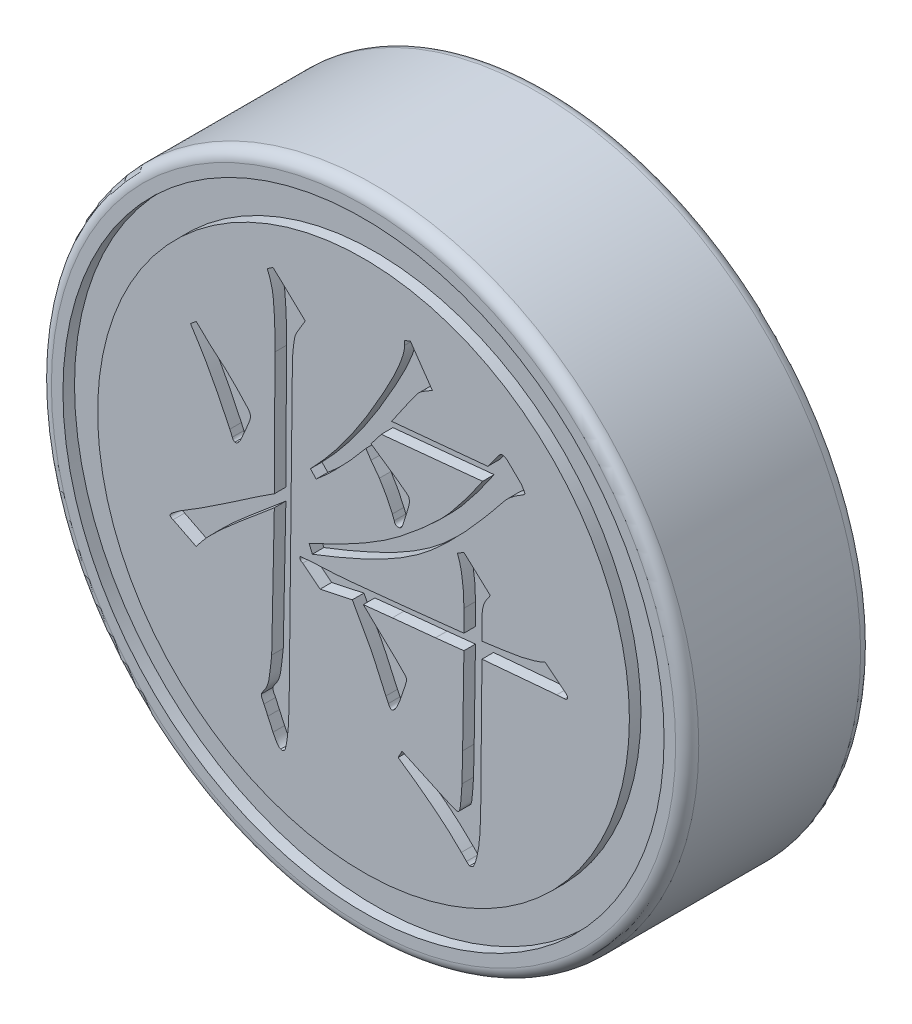
from build123d import *

# Parameters (mm, degrees)
SKETCH_1_R          = 14
EXTRUDE_1_DEPTH     = 8
SKETCH_2_R          = 13
SKETCH_2_R_2        = 11.5
CUT_EXTRUDE_1_DEPTH = 0.5
SKETCH_3_R          = 5.1
CUT_EXTRUDE_2_DEPTH = 5
CHAMFER_1_SIZE      = 0.5
FILLET_1_R          = 0.5
CUT_EXTRUDE_4_DEPTH = 0.5


with BuildPart() as part:
    # 草图1 → 凸台-拉伸1 (new body)
    with BuildSketch(Plane.XY):
        Circle(SKETCH_1_R)
    extrude(amount=EXTRUDE_1_DEPTH)

    # 草图2 → 切除-拉伸1 (cut)
    with BuildSketch(Plane.XY.offset(8)):
        Circle(SKETCH_2_R)
        Circle(SKETCH_2_R_2, mode=Mode.SUBTRACT)
    extrude(amount=-CUT_EXTRUDE_1_DEPTH, mode=Mode.SUBTRACT)

    # 草图3 → 切除-拉伸2 (cut)
    with BuildSketch(Plane(origin=(0, 0, 0), x_dir=(-1, 0, 0), z_dir=(0, 0, -1))):
        Circle(SKETCH_3_R)
    extrude(amount=-CUT_EXTRUDE_2_DEPTH, mode=Mode.SUBTRACT)

    # 倒角1
    chamfer_1_edges = [part.edges().sort_by_distance(p)[0] for p in [
        (5.1, 0, 0),
    ]]
    chamfer(chamfer_1_edges, length=CHAMFER_1_SIZE)

    # 圆角1
    fillet_1_edges = [part.edges().sort_by_distance(p)[0] for p in [
        (-14, 0, 0),
        (-14, 0, 8),
    ]]
    fillet(fillet_1_edges, radius=FILLET_1_R)

    # 草图5 → 切除-拉伸4 (cut)
    with BuildSketch(Plane.XY.offset(8)):
        with BuildLine():
            Line((-3.85785957, 0.753181604), (-3.830158739, 6.08005141))
            add(Edge.make_bspline(
                [(-3.830158739, 6.08005141), (-3.831364823, 6.224089211), (-3.833645566, 6.49646907), (-3.832589616, 6.878881899), (-3.846872254, 7.211166179), (-3.855467977, 7.497624344), (-3.873070618, 7.746912058), (-3.892573003, 7.96760547), (-3.91330196, 8.163780836), (-3.951159163, 8.398958357), (-4.022230098, 8.692417239), (-4.11578704, 8.916857126), (-4.165338794, 9.03573008)],
                knots=[0, 0, 0, 0, 1.441948632, 2.726768687, 3.82731529, 4.770833155, 5.5953337, 6.328397192, 6.988807953, 7.569284558, 8.712589244, 10, 10, 10, 10], degree=3))
            Line((-4.165338794, 9.03573008), (-3.913261232, 9.20470515))
            Line((-3.913261232, 9.20470515), (-2.519909431, 7.894455842))
            add(Edge.make_bspline(
                [(-2.519909431, 7.894455842), (-2.574703725, 7.806940328), (-2.671681638, 7.652050627), (-2.796092194, 7.444535731), (-2.880684556, 7.292009214), (-2.938139052, 7.181515682), (-2.970150997, 7.082319931), (-2.993870979, 6.968104268), (-3.014553443, 6.824493455), (-3.043932148, 6.60149774), (-3.068391363, 6.319705215), (-3.074031335, 6.094869904), (-3.076696135, 5.988638668)],
                knots=[0, 0, 0, 0, 1.52542796, 2.699785109, 3.572888092, 4.103644722, 4.534997392, 5.107576427, 5.825231127, 6.677957643, 8.43038593, 10, 10, 10, 10], degree=3))
            Line((-3.076696135, 5.988638668), (-3.217970373, -6.87562726))
            add(Edge.make_bspline(
                [(-3.217970373, -6.87562726), (-3.222362694, -6.998442437), (-3.230323012, -7.221023575), (-3.24400192, -7.520225409), (-3.257039544, -7.750205328), (-3.274995679, -7.966686115), (-3.306652214, -8.197528505), (-3.340841548, -8.416139218), (-3.385076311, -8.571843104), (-3.427760128, -8.658985824), (-3.506588605, -8.694052613), (-3.555081376, -8.678765136), (-3.580851259, -8.670641111)],
                knots=[0, 0, 0, 0, 1.884211783, 3.414806023, 4.591967612, 5.416119352, 6.743635864, 8.168157045, 8.790582467, 9.242277468, 9.597333355, 10, 10, 10, 10], degree=3))
            add(Edge.make_bspline(
                [(-3.580851259, -8.670641111), (-3.606015163, -8.658243583), (-3.668642248, -8.62738903), (-3.742174602, -8.523978304), (-3.830488817, -8.38402528), (-3.883323333, -8.269922057), (-3.913261232, -8.20526715)],
                knots=[0, 0, 0, 0, 0.570505039, 1.419853925, 2.537998313, 4, 4, 4, 4], degree=3))
            Line((-3.913261232, -8.20526715), (-4.137637963, -7.717732524))
            Line((-4.137637963, -7.717732524), (-4.303842949, -7.343771305))
            add(Edge.make_bspline(
                [(-4.303842949, -7.343771305), (-4.32504177, -7.307225751), (-4.362886764, -7.241983148), (-4.401541068, -7.151267356), (-4.423739186, -7.080499123), (-4.419217867, -7.04096431), (-4.417416356, -7.025211748)],
                knots=[0, 0, 0, 0, 1.469798198, 2.623943312, 3.451713122, 4, 4, 4, 4], degree=3))
            add(Edge.make_bspline(
                [(-4.417416356, -7.025211748), (-4.415159561, -7.014832831), (-4.408727343, -6.9852513), (-4.371189361, -6.937345293), (-4.328937288, -6.861241226), (-4.257216751, -6.769682701), (-4.185529109, -6.646723467), (-4.129795655, -6.488578794), (-4.082034128, -6.301525957), (-4.052994762, -6.091253604), (-4.032095077, -5.877199721), (-4.003603181, -5.679370942), (-3.989733879, -5.503338748), (-3.97725415, -5.394526708), (-3.971432977, -5.343771305)],
                knots=[0, 0, 0, 0, 0.214283448, 0.610741237, 1.210381572, 1.992533091, 2.969273694, 4.093299855, 5.392392195, 6.894141364, 8.407137992, 9.770829503, 10.960202871, 12, 12, 12, 12], degree=3))
            Line((-3.971432977, -5.343771305), (-3.85785957, 0.229635897))
            add(Edge.make_bspline(
                [(-3.85785957, 0.229635897), (-3.878168271, 0.212085931), (-3.931667913, 0.165853683), (-4.030456688, 0.080892432), (-4.166425216, -0.03626467), (-4.34208605, -0.182650137), (-4.554173082, -0.36321896), (-4.807295954, -0.572327291), (-5.094132861, -0.817754139), (-5.411860666, -1.081224253), (-5.731018076, -1.355874669), (-6.034312357, -1.620285881), (-6.304960618, -1.873475406), (-6.54997969, -2.107753196), (-6.764060334, -2.329029957), (-6.94640986, -2.537366606), (-7.103209677, -2.727539495), (-7.192739092, -2.852993233), (-7.234590872, -2.911638341)],
                knots=[0, 0, 0, 0, 0.278685964, 0.734148355, 1.352868484, 2.142160163, 3.10822288, 4.24488939, 5.550987281, 7.027679045, 8.530285071, 9.922791131, 11.204918628, 12.37787845, 13.442390712, 14.400188368, 15.252145634, 16, 16, 16, 16], degree=3))
            Line((-7.234590872, -2.911638341), (-8.237360955, -2.407483216))
            add(Edge.make_bspline(
                [(-8.237360955, -2.407483216), (-8.268226367, -2.396060064), (-8.320865709, -2.376578477), (-8.370874276, -2.317358574), (-8.360498999, -2.263066682), (-8.328526619, -2.221551263), (-8.277472307, -2.174596766), (-8.234151236, -2.144640361), (-8.209660124, -2.127704823)],
                knots=[0, 0, 0, 0, 1.439162286, 2.454415798, 2.983503706, 3.708684787, 4.704629022, 6, 6, 6, 6], degree=3))
            Line((-8.209660124, -2.127704823), (-7.960352645, -1.939339172))
            add(Edge.make_bspline(
                [(-7.960352645, -1.939339172), (-7.93918096, -1.925385613), (-7.882701613, -1.88816194), (-7.774140588, -1.82247495), (-7.62246854, -1.731481042), (-7.427173109, -1.615556443), (-7.195079146, -1.469576338), (-6.923872444, -1.29698057), (-6.618650075, -1.094548698), (-6.168217807, -0.797906513), (-5.612727534, -0.422403151), (-4.980875947, 0.009225753), (-4.407715733, 0.403523039), (-4.034883002, 0.640610784), (-3.85785957, 0.753181604)],
                knots=[0, 0, 0, 0, 0.185978253, 0.496131053, 0.930549877, 1.483446561, 2.161889833, 2.941600705, 3.841406625, 4.848274833, 6.897709729, 8.759390539, 10.461337318, 12, 12, 12, 12], degree=3))
        make_face()
        with BuildLine():
            add(Edge.make_bspline(
                [(-7.234590872, 5.520494623), (-7.106952653, 5.39510488), (-6.86042924, 5.152924222), (-6.55102862, 4.86846664), (-6.321426398, 4.668952666), (-6.175539, 4.546298415), (-6.056009645, 4.445040552), (-5.983497833, 4.385610435), (-5.952042395, 4.359829803)],
                knots=[0, 0, 0, 0, 1.86104033, 3.594456432, 4.370579403, 5.024813142, 5.57696645, 6, 6, 6, 6], degree=3))
            Line((-5.952042395, 4.359829803), (-5.475588102, 3.894455842))
            add(Edge.make_bspline(
                [(-5.475588102, 3.894455842), (-5.409433579, 3.823995593), (-5.293663164, 3.700690156), (-5.139509956, 3.544058542), (-5.043410646, 3.429392174), (-4.968221874, 3.349165923), (-4.919928105, 3.26590827), (-4.885660092, 3.174760047), (-4.893469988, 3.067185301), (-4.926323425, 2.940143641), (-4.997972846, 2.76884447), (-5.053527587, 2.638610177), (-5.085006384, 2.564815953)],
                knots=[0, 0, 0, 0, 1.835389117, 3.211930954, 4.168491122, 4.678116715, 5.291474079, 5.990105516, 6.481304776, 7.310498234, 8.476056557, 10, 10, 10, 10], degree=3))
            Line((-5.085006384, 2.564815953), (-5.253981453, 2.174234235))
            add(Edge.make_bspline(
                [(-5.253981453, 2.174234235), (-5.279038037, 2.119443296), (-5.323185359, 2.022906859), (-5.401374207, 1.912425946), (-5.478997172, 1.83694058), (-5.536523997, 1.836482615), (-5.561460678, 1.836284097)],
                knots=[0, 0, 0, 0, 1.485332214, 2.617014426, 3.400504558, 4, 4, 4, 4], degree=3))
            add(Edge.make_bspline(
                [(-5.561460678, 1.836284097), (-5.58717967, 1.84775568), (-5.644075044, 1.873133035), (-5.662285437, 1.933434965), (-5.672264002, 1.966478003)],
                knots=[0, 0, 0, 0, 0.904080267, 2, 2, 2, 2], degree=3))
            Line((-5.672264002, 1.966478003), (-5.783067326, 2.210245316))
            add(Edge.make_bspline(
                [(-5.783067326, 2.210245316), (-5.794090607, 2.235201752), (-5.819471471, 2.292663397), (-5.863221377, 2.387613466), (-5.916114565, 2.502421047), (-5.980285651, 2.63655602), (-6.057306769, 2.789192237), (-6.144694351, 2.962035339), (-6.236287781, 3.156301891), (-6.386076584, 3.441991424), (-6.582029933, 3.828196396), (-6.854195545, 4.305436125), (-7.154383902, 4.805711453), (-7.372097363, 5.142539395), (-7.483898351, 5.315508474)],
                knots=[0, 0, 0, 0, 0.277114005, 0.638048908, 1.061866736, 1.561066809, 2.148278084, 2.798404853, 3.528272791, 4.329440664, 6.074544031, 7.926559789, 9.908192552, 12, 12, 12, 12], degree=3))
            Line((-7.483898351, 5.315508474), (-7.234590872, 5.520494623))
        make_face()
        with BuildLine():
            Line((4.341586414, -0.368702053), (4.341586414, 0.564815953))
            add(Edge.make_bspline(
                [(4.341586414, 0.564815953), (4.33908857, 0.754282631), (4.334325687, 1.115557243), (4.280277718, 1.627355464), (4.201159882, 2.084085915), (4.108408964, 2.359753018), (4.064578103, 2.490023709)],
                knots=[0, 0, 0, 0, 1.1625579, 2.216762637, 3.157304002, 4, 4, 4, 4], degree=3))
            Line((4.064578103, 2.490023709), (4.341586414, 2.658998778))
            Line((4.341586414, 2.658998778), (5.485630735, 1.611907366))
            add(Edge.make_bspline(
                [(5.485630735, 1.611907366), (5.447077928, 1.560707274), (5.375080852, 1.465091491), (5.283775525, 1.322711221), (5.219557286, 1.189341808), (5.162637711, 1.023908098), (5.130807343, 0.808897017), (5.125519006, 0.635973935), (5.122749849, 0.545425371)],
                knots=[0, 0, 0, 0, 0.999294173, 1.866174281, 2.632526324, 3.301844186, 4.587151401, 6, 6, 6, 6], degree=3))
            Line((5.122749849, 0.545425371), (5.122749849, -0.27728931))
            Line((5.122749849, -0.27728931), (5.959314945, -0.163715903))
            add(Edge.make_bspline(
                [(5.959314945, -0.163715903), (6.064624621, -0.14927112), (6.269045926, -0.121231709), (6.564026547, -0.075286044), (6.835840246, -0.023287321), (7.083884188, 0.036099031), (7.309663563, 0.095778331), (7.513524093, 0.15905984), (7.693921276, 0.227742126), (7.8044693, 0.279782988), (7.856821871, 0.304428141)],
                knots=[0, 0, 0, 0, 1.29992086, 2.523334313, 3.650570314, 4.683168317, 5.641870218, 6.506143093, 7.292549546, 8, 8, 8, 8], degree=3))
            Line((7.856821871, 0.304428141), (8.721087799, -0.388092634))
            add(Edge.make_bspline(
                [(8.721087799, -0.388092634), (8.740464429, -0.406358154), (8.77455575, -0.438494582), (8.820489883, -0.484145019), (8.832454808, -0.53491267), (8.820704388, -0.589665486), (8.770940503, -0.640192245), (8.719333159, -0.647550887), (8.693386968, -0.651250529)],
                knots=[0, 0, 0, 0, 1.258283104, 2.213828307, 2.971585882, 3.592822859, 4.789763726, 6, 6, 6, 6], degree=3))
            Line((8.693386968, -0.651250529), (8.358206912, -0.667871028))
            add(Edge.make_bspline(
                [(8.358206912, -0.667871028), (8.347122249, -0.668748321), (8.318450862, -0.671017511), (8.264022604, -0.677098947), (8.187506653, -0.685767367), (8.086689146, -0.693171301), (7.963878259, -0.704223876), (7.818170528, -0.719190044), (7.649926953, -0.731782695), (7.458813147, -0.748676242), (7.245663051, -0.768819244), (7.009135088, -0.787417055), (6.750568739, -0.809303752), (6.469156415, -0.835778599), (6.164979144, -0.858038126), (5.837745458, -0.892208153), (5.487237218, -0.916182683), (5.246434637, -0.938801615), (5.122749849, -0.950419504)],
                knots=[0, 0, 0, 0, 0.164324807, 0.425039533, 0.80932656, 1.302300981, 1.9188117, 2.631699032, 3.46692313, 4.412080204, 5.467188615, 6.63106211, 7.918463972, 9.302214914, 10.808338471, 12.425599053, 14.164060283, 16, 16, 16, 16], degree=3))
            Line((5.122749849, -0.950419504), (5.067348186, -6.745433355))
            add(Edge.make_bspline(
                [(5.067348186, -6.745433355), (5.064875182, -6.890455427), (5.059656815, -7.19647121), (5.032462237, -7.582244321), (5.007443253, -7.894873373), (4.974195392, -8.110452313), (4.944168262, -8.302526578), (4.9035413, -8.469019196), (4.866659417, -8.610112557), (4.827222203, -8.722940971), (4.794052736, -8.810509836), (4.75972915, -8.887399054), (4.694112066, -8.955498994), (4.627549792, -8.953968658), (4.593663976, -8.953189587)],
                knots=[0, 0, 0, 0, 2.210875522, 4.665240206, 5.895144627, 6.990112605, 7.989908319, 8.857243241, 9.601752263, 10.211648379, 10.679604218, 11.025863496, 11.504082285, 12, 12, 12, 12], degree=3))
            add(Edge.make_bspline(
                [(4.593663976, -8.953189587), (4.572585822, -8.946102109), (4.518221498, -8.927822238), (4.479108137, -8.885140142), (4.455159821, -8.859006762)],
                knots=[0, 0, 0, 0, 0.775440652, 2, 2, 2, 2], degree=3))
            Line((4.455159821, -8.859006762), (4.23078309, -8.634630031))
            add(Edge.make_bspline(
                [(4.23078309, -8.634630031), (4.15186739, -8.554721064), (3.987568231, -8.388353965), (3.720323803, -8.13809174), (3.421859872, -7.879624489), (3.094690785, -7.611082639), (2.738548434, -7.33255124), (2.350825322, -7.0466887), (1.936040597, -6.74599511), (1.64588011, -6.548034334), (1.496711067, -6.44626438)],
                knots=[0, 0, 0, 0, 0.768323442, 1.599617016, 2.504114921, 3.469089618, 4.495216237, 5.59696275, 6.764618955, 8, 8, 8, 8], degree=3))
            Line((1.496711067, -6.44626438), (1.665686137, -6.127704823))
            Line((1.665686137, -6.127704823), (3.421918824, -6.933799006))
            add(Edge.make_bspline(
                [(3.421918824, -6.933799006), (3.50928182, -6.974806709), (3.661674462, -7.046338965), (3.861167754, -7.122775986), (3.996282944, -7.179582287), (4.068104325, -7.176001504), (4.092278934, -7.174796236)],
                knots=[0, 0, 0, 0, 1.609584327, 2.807696817, 3.598678508, 4, 4, 4, 4], degree=3))
            add(Edge.make_bspline(
                [(4.092278934, -7.174796236), (4.10639014, -7.163666298), (4.141353303, -7.136089786), (4.165902222, -7.054598367), (4.191000238, -6.946510599), (4.209730637, -6.74152988), (4.232511591, -6.441031151), (4.249457377, -6.187801106), (4.258483921, -6.052912579)],
                knots=[0, 0, 0, 0, 0.27594169, 0.683697398, 1.275878774, 2.031921205, 3.886315964, 6, 6, 6, 6], degree=3))
            Line((4.258483921, -6.052912579), (4.286184752, -4.800835017))
            Line((4.286184752, -4.800835017), (4.341586414, -1.025211748))
            add(Edge.make_bspline(
                [(4.341586414, -1.025211748), (4.211394855, -1.039084443), (3.969466164, -1.064863402), (3.635133719, -1.100166039), (3.356538089, -1.13217786), (3.189253699, -1.148227722), (3.114439599, -1.155405654)],
                knots=[0, 0, 0, 0, 1.273167656, 2.365866006, 3.269171123, 4, 4, 4, 4], degree=3))
            Line((3.114439599, -1.155405654), (1.247403588, -1.341001222))
            Line((1.247403588, -1.341001222), (-0.01021414, -1.473965211))
            Line((-0.01021414, -1.473965211), (1.413608574, -2.820225598))
            add(Edge.make_bspline(
                [(1.413608574, -2.820225598), (1.470626235, -2.877648015), (1.56902768, -2.976747993), (1.696253654, -3.100278547), (1.770723957, -3.181817705), (1.81825512, -3.225903565), (1.837744405, -3.268765221), (1.865974723, -3.314544439), (1.8588633, -3.399611951), (1.826900897, -3.519932315), (1.771452333, -3.702667337), (1.721780725, -3.842682099), (1.693386968, -3.922718673)],
                knots=[0, 0, 0, 0, 1.86363274, 3.216269406, 4.07307112, 4.419071504, 4.685391313, 5.151541843, 5.619143805, 6.578196634, 8.043996127, 10, 10, 10, 10], degree=3))
            Line((1.693386968, -3.922718673), (1.552112729, -4.332690972))
            add(Edge.make_bspline(
                [(1.552112729, -4.332690972), (1.527959705, -4.389382633), (1.48453181, -4.491316013), (1.415875429, -4.623827865), (1.35096557, -4.719769824), (1.290603065, -4.780055622), (1.226197043, -4.809298835), (1.163701487, -4.781555965), (1.113713305, -4.719733054), (1.091419665, -4.664213052), (1.078428519, -4.631859947)],
                knots=[0, 0, 0, 0, 1.795557287, 3.228468177, 4.348662079, 5.148948399, 5.719299692, 6.264318123, 6.988568189, 8, 8, 8, 8], degree=3))
            Line((1.078428519, -4.631859947), (0.967625195, -4.407483216))
            add(Edge.make_bspline(
                [(0.967625195, -4.407483216), (0.927990788, -4.317886121), (0.852742142, -4.147779875), (0.744822058, -3.906727804), (0.647308049, -3.692760959), (0.561400086, -3.504411875), (0.487288833, -3.341585222), (0.423727299, -3.205768947), (0.370810982, -3.096935219), (0.324762043, -3.005926224), (0.278782123, -2.911612329), (0.216902639, -2.800415046), (0.142965797, -2.656774257), (0.047751344, -2.487506159), (-0.058729424, -2.286196832), (-0.187814803, -2.060987175), (-0.328384357, -1.803796219), (-0.430085024, -1.624329105), (-0.483898351, -1.529366873)],
                knots=[0, 0, 0, 0, 1.457860568, 2.767848542, 3.92999225, 4.956818484, 5.848328886, 6.592065526, 7.188132661, 7.648984822, 8.109836983, 8.749151134, 9.542031172, 10.513592834, 11.638676341, 12.930524587, 14.375834816, 16, 16, 16, 16], degree=3))
            add(Edge.make_bspline(
                [(-0.483898351, -1.529366873), (-0.589154532, -1.551560444), (-0.785846893, -1.593033599), (-1.060257646, -1.650391645), (-1.293155416, -1.702718072), (-1.488384628, -1.738068689), (-1.641531678, -1.77615801), (-1.756272078, -1.800894507), (-1.830359227, -1.816606985), (-1.866180706, -1.825719825), (-1.877250151, -1.828535848)],
                knots=[0, 0, 0, 0, 1.811492459, 3.385138273, 4.720942415, 5.830958609, 6.724882073, 7.377588001, 7.807664115, 8, 8, 8, 8], degree=3))
            Line((-1.877250151, -1.828535848), (-2.630712755, -1.230197898))
            add(Edge.make_bspline(
                [(-2.630712755, -1.230197898), (-2.660766827, -1.215964762), (-2.708248141, -1.193478358), (-2.746624708, -1.132718444), (-2.740458842, -1.084146626), (-2.741171328, -1.055630414), (-2.741516079, -1.041832247)],
                knots=[0, 0, 0, 0, 1.630760917, 2.576378806, 3.311151035, 4, 4, 4, 4], degree=3))
            add(Edge.make_bspline(
                [(-2.741516079, -1.041832247), (-2.73418085, -1.038894487), (-2.709335103, -1.028943765), (-2.653143457, -1.02012266), (-2.565155857, -1.013829038), (-2.445249505, -1.00121831), (-2.293739597, -0.991191557), (-2.109991524, -0.979910341), (-1.893908666, -0.968987048), (-1.643618295, -0.958315663), (-1.357211278, -0.945375495), (-1.033071772, -0.922791731), (-0.670488952, -0.890474419), (-0.267594654, -0.85896547), (0.173776703, -0.817082714), (0.654642587, -0.766096611), (1.174543676, -0.711141127), (1.534582151, -0.671687918), (1.721087799, -0.651250529)],
                knots=[0, 0, 0, 0, 0.084491318, 0.286187336, 0.604021675, 1.031082835, 1.576412179, 2.230281157, 3.002633689, 3.89351875, 4.913281126, 6.072991064, 7.373003951, 8.811805274, 10.400976972, 12.121002453, 13.990617664, 16, 16, 16, 16], degree=3))
            Line((1.721087799, -0.651250529), (4.341586414, -0.368702053))
        make_face()
        with BuildLine():
            add(Edge.make_bspline(
                [(-2.353704445, -0.352081554), (-2.139108884, -0.253158075), (-1.720118615, -0.06001347), (-1.114619802, 0.235350503), (-0.547216422, 0.529506483), (-0.019096496, 0.822743801), (0.472681214, 1.112664298), (0.923900149, 1.403749377), (1.337683477, 1.691040301), (1.712875321, 1.978090198), (2.054771484, 2.25948782), (2.374678063, 2.52479125), (2.668422024, 2.779643534), (2.936793146, 3.022979047), (3.180552736, 3.25393444), (3.403307119, 3.468040441), (3.597852084, 3.673678866), (3.826986449, 3.93808399), (4.1030473, 4.281858701), (4.44122167, 4.721639797), (4.792677212, 5.207563414), (5.028303277, 5.54865866), (5.15045068, 5.725480773)],
                knots=[0, 0, 0, 0, 1.445318383, 2.821933198, 4.120347755, 5.354075207, 6.516406363, 7.611476489, 8.637722466, 9.596758907, 10.500007855, 11.346072926, 12.138785553, 12.878480593, 13.561682939, 14.192726795, 14.768031127, 15.292429681, 16.332384657, 17.464280717, 18.68549549, 20, 20, 20, 20], degree=3))
            Line((5.15045068, 5.725480773), (0.770949295, 5.296117892))
            Line((0.770949295, 5.296117892), (0.324965915, 4.717170523))
            Line((0.324965915, 4.717170523), (1.441309405, 3.949857504))
            add(Edge.make_bspline(
                [(1.441309405, 3.949857504), (1.508588703, 3.898994742), (1.629014918, 3.807953215), (1.78769377, 3.690164666), (1.896961356, 3.610679303), (1.958391655, 3.546004684), (1.972101559, 3.480909403), (1.986191465, 3.423362333), (1.98507207, 3.35290716), (1.972531983, 3.274327179), (1.950253808, 3.170478204), (1.927622997, 3.094661149), (1.914993616, 3.052350579)],
                knots=[0, 0, 0, 0, 2.18585599, 3.912561096, 5.104009388, 5.716537789, 6.140316499, 6.797005865, 7.251394972, 7.951502459, 8.856812643, 10, 10, 10, 10], degree=3))
            Line((1.914993616, 3.052350579), (1.776489461, 2.603597116))
            add(Edge.make_bspline(
                [(1.776489461, 2.603597116), (1.758896906, 2.542291542), (1.727704942, 2.433595492), (1.675700884, 2.294798998), (1.598147858, 2.192257304), (1.499750951, 2.175866296), (1.427138101, 2.192663666), (1.379895612, 2.225400384), (1.344288121, 2.275907949), (1.335372026, 2.31765554), (1.330506081, 2.340439222)],
                knots=[0, 0, 0, 0, 1.923168458, 3.409817452, 4.495965922, 5.606191013, 6.181089108, 6.722549981, 7.302833656, 8, 8, 8, 8], degree=3))
            Line((1.330506081, 2.340439222), (1.247403588, 2.548195454))
            add(Edge.make_bspline(
                [(1.247403588, 2.548195454), (1.212394336, 2.631758487), (1.139874349, 2.804855305), (1.007419117, 3.064083802), (0.858747642, 3.33685229), (0.74602778, 3.518268426), (0.687846801, 3.611907366)],
                knots=[0, 0, 0, 0, 0.903109914, 1.870748911, 2.900975293, 4, 4, 4, 4], degree=3))
            Line((0.687846801, 3.611907366), (0.324965915, 4.099441992))
            Line((0.324965915, 4.099441992), (0.103359267, 4.434622047))
            add(Edge.make_bspline(
                [(0.103359267, 4.434622047), (-0.068364081, 4.228005154), (-0.407182816, 3.820339714), (-0.94109834, 3.245001549), (-1.481593891, 2.70464964), (-1.859721982, 2.373551889), (-2.046225221, 2.210245316)],
                knots=[0, 0, 0, 0, 1.040672306, 2.053298389, 3.039832891, 4, 4, 4, 4], degree=3))
            Line((-2.046225221, 2.210245316), (-2.2955327, 2.47340321))
            add(Edge.make_bspline(
                [(-2.2955327, 2.47340321), (-2.147169992, 2.62897057), (-1.847818532, 2.942858857), (-1.423297603, 3.443967705), (-1.006269832, 3.9677487), (-0.600161561, 4.522513568), (-0.199873049, 5.111838569), (0.195988677, 5.743326872), (0.593765875, 6.414471113), (0.91758247, 6.995400047), (1.162414891, 7.459978741), (1.327388405, 7.78252673), (1.462962988, 8.078816996), (1.573161264, 8.345423144), (1.665665338, 8.580256294), (1.724858741, 8.789413528), (1.76935222, 8.968320143), (1.774278381, 9.079852309), (1.776489461, 9.129912906)],
                knots=[0, 0, 0, 0, 1.309143698, 2.641459455, 3.998533803, 5.386673151, 6.828059429, 8.336970686, 9.925606818, 11.579726175, 12.387309009, 13.124277566, 13.786171952, 14.371092867, 14.881908832, 15.321499915, 15.695458983, 16, 16, 16, 16], degree=3))
            Line((1.776489461, 9.129912906), (1.776489461, 9.315508474))
            Line((1.776489461, 9.315508474), (2.028567023, 9.409691299))
            Line((2.028567023, 9.409691299), (2.975935444, 8.04404033))
            add(Edge.make_bspline(
                [(2.975935444, 8.04404033), (2.907118202, 8.006067651), (2.781976265, 7.937015557), (2.617475117, 7.831620634), (2.485967147, 7.747209544), (2.397451799, 7.670602259), (2.326781679, 7.591819777), (2.254675875, 7.489381054), (2.147403554, 7.349401723), (2.015580398, 7.162907051), (1.85550182, 6.93351879), (1.667242771, 6.661968122), (1.45040556, 6.34855439), (1.298019825, 6.124488565), (1.216932674, 6.005259166)],
                knots=[0, 0, 0, 0, 1.035515218, 1.883051056, 2.575025499, 3.092496975, 3.419955639, 3.967601382, 4.741611193, 5.744650632, 6.976939942, 8.428580624, 10.099584419, 12, 12, 12, 12], degree=3))
            Line((1.216932674, 6.005259166), (5.374827411, 6.398610967))
            Line((5.374827411, 6.398610967), (5.848511621, 7.03573008))
            add(Edge.make_bspline(
                [(5.848511621, 7.03573008), (5.871043021, 7.064294511), (5.912628254, 7.117014647), (6.011792307, 7.154550756), (6.118147569, 7.123618142), (6.177963085, 7.07790085), (6.211392508, 7.052350579)],
                knots=[0, 0, 0, 0, 1.015728073, 1.874685466, 2.812213905, 4, 4, 4, 4], degree=3))
            Line((6.211392508, 7.052350579), (6.826350957, 6.454012629))
            Line((6.826350957, 6.454012629), (6.937154281, 6.268417061))
            add(Edge.make_bspline(
                [(6.937154281, 6.268417061), (6.944555796, 6.251643607), (6.957223179, 6.222936542), (6.981523256, 6.190741044), (6.975805681, 6.158893347), (6.949790486, 6.134190451), (6.910103183, 6.099254884), (6.874869433, 6.076736035), (6.854051788, 6.063430911)],
                knots=[0, 0, 0, 0, 1.227140572, 2.100199854, 2.471109105, 3.251997066, 4.376359331, 6, 6, 6, 6], degree=3))
            add(Edge.make_bspline(
                [(6.854051788, 6.063430911), (6.797219082, 6.031009986), (6.680962005, 5.964689686), (6.517067301, 5.850416371), (6.36360191, 5.730112768), (6.243705666, 5.624078599), (6.148730609, 5.525635875), (6.067238215, 5.427318214), (5.966920016, 5.310199492), (5.876885094, 5.192886578), (5.790705961, 5.081619688), (5.708395887, 4.9758582), (5.605362575, 4.855924466), (5.487788302, 4.715835143), (5.356294784, 4.555793305), (5.206730455, 4.377670901), (5.036410129, 4.185592889), (4.793759958, 3.898055146), (4.465226548, 3.533031278), (4.054521068, 3.094921238), (3.620414318, 2.666208861), (3.170006522, 2.239460258), (2.686478839, 1.824679505), (2.155452257, 1.435496617), (1.580932096, 1.063923337), (0.955887518, 0.709419897), (0.26927154, 0.364507972), (-0.488519895, 0.017072423), (-1.321343904, -0.341715694), (-1.907860953, -0.569155584), (-2.212430207, -0.687261609)],
                knots=[0, 0, 0, 0, 0.478113913, 0.978030616, 1.458758101, 1.903291138, 2.146762553, 2.457926161, 2.836473028, 3.273980699, 3.538615079, 3.865419659, 4.253476249, 4.694252239, 5.202440059, 5.767676671, 6.39441774, 7.078977677, 8.517949816, 9.983900129, 11.468320711, 12.977353817, 14.519272138, 16.121788708, 17.786270228, 19.518532314, 21.372054907, 23.401632018, 25.612138454, 28, 28, 28, 28], degree=3))
            Line((-2.212430207, -0.687261609), (-2.353704445, -0.352081554))
        make_face()
    extrude(amount=-CUT_EXTRUDE_4_DEPTH, mode=Mode.SUBTRACT)


solid = part.part
